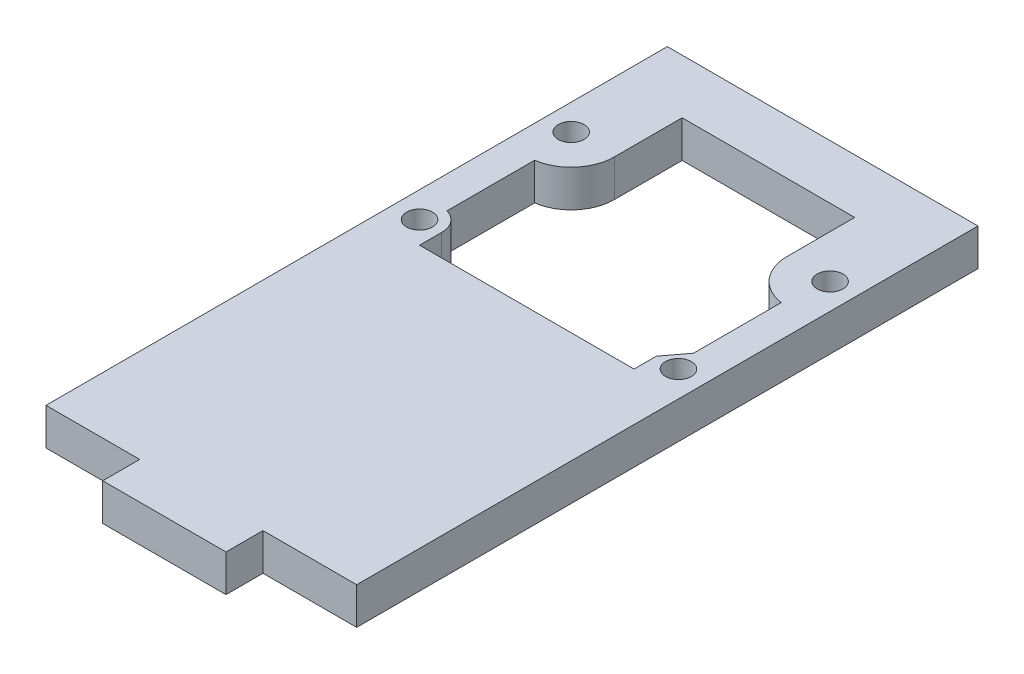
from build123d import *

# Parameters (mm, degrees)
BOSS_EXTRUDE1_DEPTH = 3
SKETCH2_R           = 1.05
CUT_EXTRUDE1_DEPTH  = 10
CUT_EXTRUDE4_DEPTH  = 10
BOSS_EXTRUDE2_DEPTH = 3


with BuildPart() as part:
    # Sketch1 → Boss-Extrude1 (new body)
    with BuildSketch(Plane(origin=(0, 0, 0), x_dir=(1, 0, 0), z_dir=(0, 1, 0))):
        Polygon((-12.6, -12), (-12.6, -32), (-5, -32), (-5, -35), (0, -35), (5, -35), (5, -32), (12.6, -32), (12.6, -12), (12.6, 12), (-12.6, 12), align=None)
    extrude(amount=BOSS_EXTRUDE1_DEPTH)

    # Sketch2 → Cut-Extrude1 (cut)
    with BuildSketch(Plane.XZ):
        with Locations(Location((10.5, -8.5, 0), (0, 0, 270))):
            Circle(SKETCH2_R)
        with Locations(Location((-10.5, -8.5, 0), (0, 0, 270))):
            Circle(SKETCH2_R)
        with Locations(Location((-10.5, 3.8, 0), (0, 0, 270))):
            Circle(SKETCH2_R)
        with Locations(Location((10.5, 3.8, 0), (0, 0, 270))):
            Circle(SKETCH2_R)
    extrude(amount=-CUT_EXTRUDE1_DEPTH, mode=Mode.SUBTRACT)

    # Sketch5 → Cut-Extrude4 (cut)
    with BuildSketch(Plane(origin=(0, 0, 0), x_dir=(-1, 0, 0), z_dir=(0, -1, 0))):
        with BuildLine():
            Line((-10, 5.035898385), (-10, -1.863508327))
            Line((-10, -1.863508327), (-10, -2.070838353))
            Line((-10, -2.070838353), (-8.7, -3.8))
            Line((-8.7, -3.8), (-8.7, -5.6))
            Line((-8.7, -5.6), (8.7, -5.6))
            Line((8.7, -5.6), (8.7, -3.8))
            ThreePointArc((8.7, -3.8), (9.061250543, -2.718334617), (10, -2.070838353))
            Line((10, -2.070838353), (10, -1.863508327))
            Line((10, -1.863508327), (10, 5.035898385))
            ThreePointArc((10, 5.035898385), (7.854248689, 6.208712153), (7, 8.5))
            Line((7, 8.5), (7, 12))
            Line((7, 12), (-7, 12))
            Line((-7, 12), (-7, 8.5))
            ThreePointArc((-7, 8.5), (-7.854248689, 6.208712153), (-10, 5.035898385))
        make_face()
    extrude(amount=-CUT_EXTRUDE4_DEPTH, mode=Mode.SUBTRACT)

    # Sketch6 → Boss-Extrude2 (add)
    with BuildSketch(Plane.XZ):
        Polygon((7, -12), (7, -14), (-7, -14), (-7, -12), (-12.6, -12), (-12.6, -18.4), (12.6, -18.4), (12.6, -12), align=None)
    extrude(amount=-BOSS_EXTRUDE2_DEPTH)


solid = part.part
